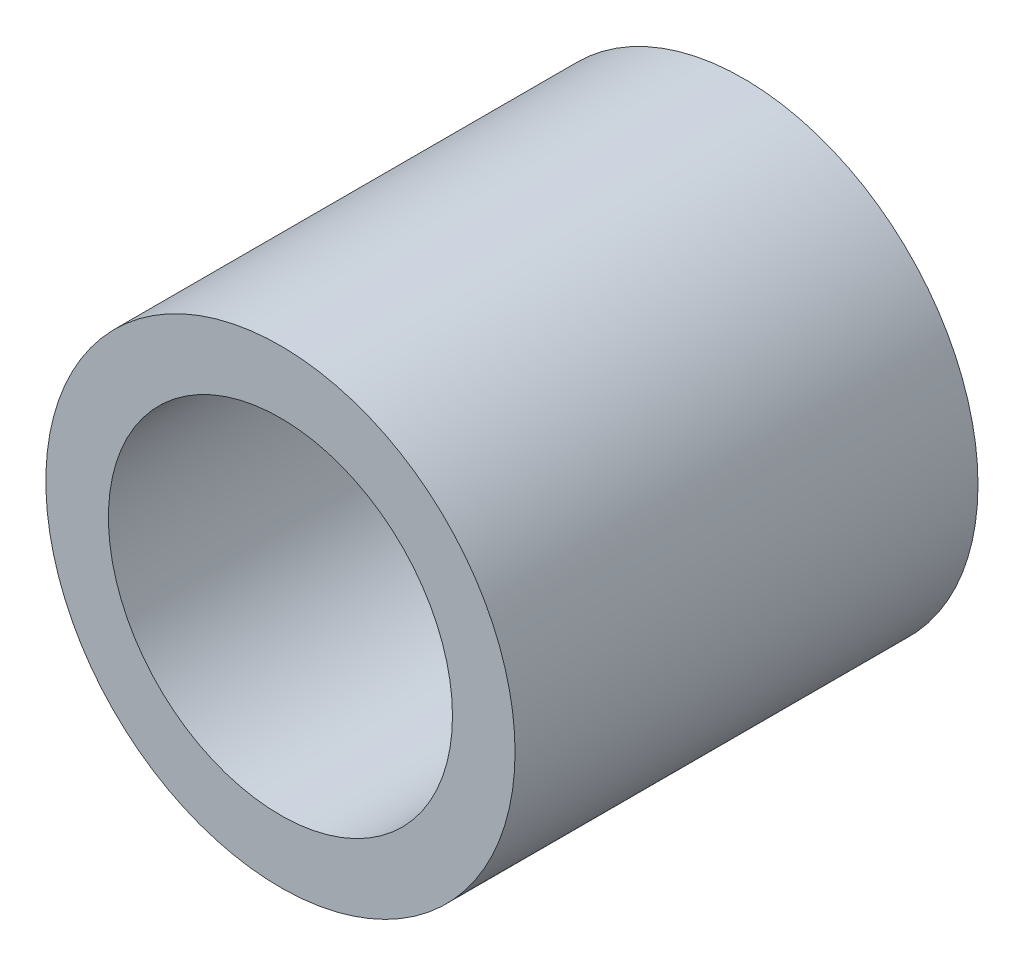
from build123d import *

# Parameters (mm, degrees)
CROQUIS2_R              = 15
CROQUIS2_R_2            = 11
SALIENTE_EXTRUIR1_DEPTH = 29.6


with BuildPart() as part:
    # Croquis2 → Saliente-Extruir1 (new body)
    with BuildSketch(Plane.XY.offset(28.1)):
        with Locations((-4.976335362, -25.8)):
            Circle(CROQUIS2_R)
        with Locations((-4.976335362, -25.8)):
            Circle(CROQUIS2_R_2, mode=Mode.SUBTRACT)
    extrude(amount=-SALIENTE_EXTRUIR1_DEPTH)


solid = part.part
